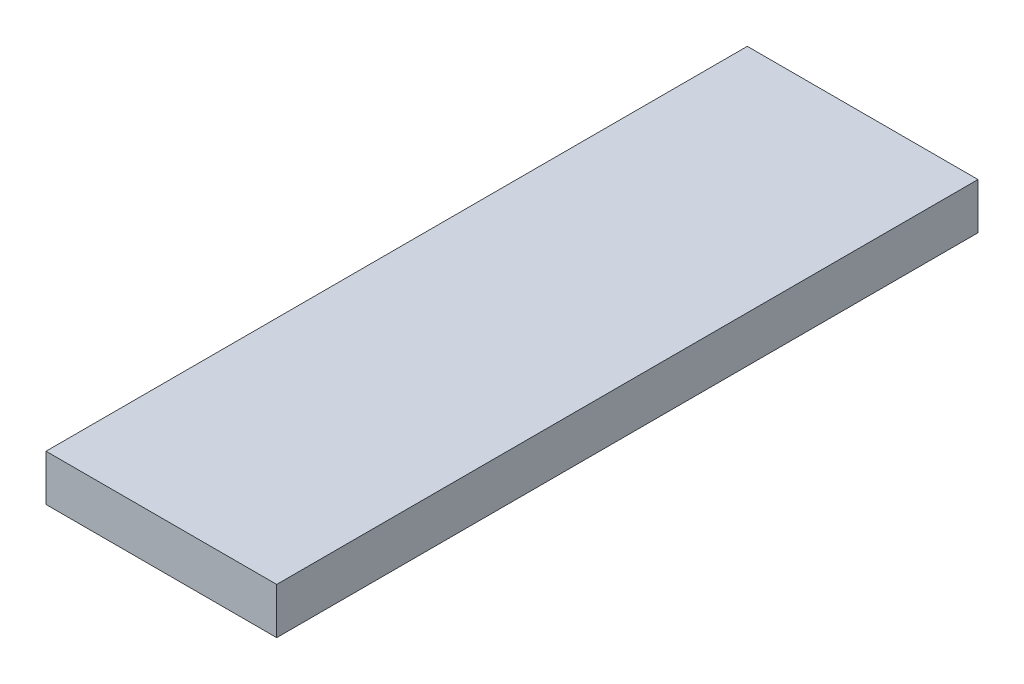
from build123d import *

# Parameters (mm, degrees)
ESQUISSE1_W        = 100
ESQUISSE1_H        = 304
BOSS_EXTRU_1_DEPTH = 20


with BuildPart() as part:
    # Esquisse1 → Boss.-Extru.1 (new body)
    with BuildSketch(Plane(origin=(0, 0, 0), x_dir=(1, 0, 0), z_dir=(0, 1, 0))):
        Rectangle(ESQUISSE1_W, ESQUISSE1_H)
    extrude(amount=BOSS_EXTRU_1_DEPTH)


solid = part.part
